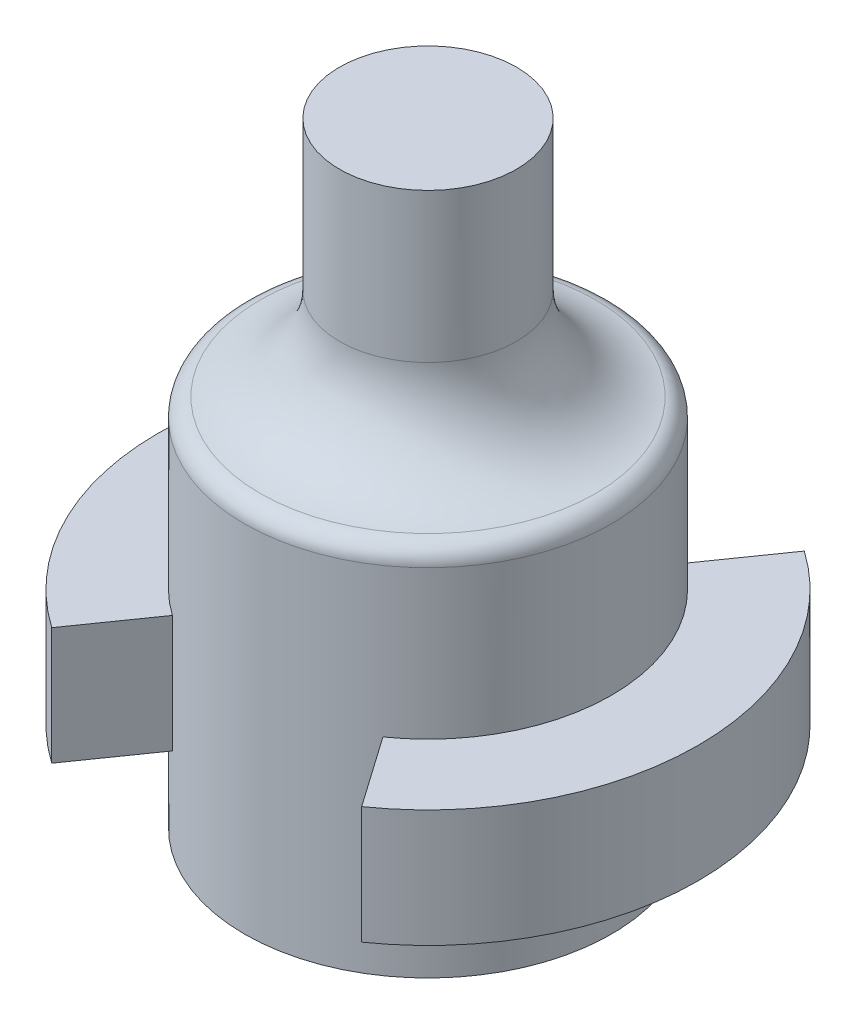
from build123d import *
from build123d.topology import SkipClean

# Parameters (mm, degrees)
SALIENTE_EXTRUIR1_START   = 0.4
SALIENTE_EXTRUIR1_DEPTH   = 3.15
SALIENTE_EXTRUIR1_2_DEPTH = 3.15
SALIENTE_EXTRUIR2_DEPTH   = 8
SALIENTE_EXTRUIR3_START   = -2
SALIENTE_EXTRUIR3_DEPTH   = 2
CROQUIS2_R                = 2.375
SALIENTE_EXTRUIR4_DEPTH   = 6.5
REDONDEO2_R               = 2.5
REDONDEO3_R               = 0.5


with BuildPart() as part:
    # Croquis1 → Saliente-Extruir1 (new body)
    with BuildSketch(Plane(origin=(0, 0, 0), x_dir=(1, 0, 0), z_dir=(0, 1, 0)).offset(SALIENTE_EXTRUIR1_START)):
        with BuildLine():
            Line((4.158429164, 5.938852321), (2.824863949, 4.034323818))
            ThreePointArc((2.824863949, 4.034323818), (4.925, 0), (2.824863949, -4.034323818))
            Line((2.824863949, -4.034323818), (4.158429164, -5.938852321))
            ThreePointArc((4.158429164, -5.938852321), (7.25, 0), (4.158429164, 5.938852321))
        make_face()
    extrude(amount=SALIENTE_EXTRUIR1_DEPTH)



with BuildPart() as body_2:
    # Croquis1 → Saliente-Extruir1 2 (new body)
    with BuildSketch(Plane(origin=(0, 0, 0), x_dir=(1, 0, 0), z_dir=(0, 1, 0)).offset(SALIENTE_EXTRUIR1_START)):
        with BuildLine():
            ThreePointArc((-2.824863949, -4.034323818), (-4.925, 0), (-2.824863949, 4.034323818))
            Line((-2.824863949, 4.034323818), (-4.158429164, 5.938852321))
            ThreePointArc((-4.158429164, 5.938852321), (-7.25, 0), (-4.158429164, -5.938852321))
            Line((-4.158429164, -5.938852321), (-2.824863949, -4.034323818))
        make_face()
    extrude(amount=SALIENTE_EXTRUIR1_2_DEPTH)


with BuildPart() as part_1:
    add(part.part)

    add(body_2.part)  # Saliente-Extruir2 merges body 2
    # Croquis1<3> → Saliente-Extruir2 (add)
    with BuildSketch(Plane(origin=(0, 0, 0), x_dir=(1, 0, 0), z_dir=(0, 1, 0))):
        with BuildLine():
            ThreePointArc((4.925, 0), (4.368528353, 2.27411192), (2.824863949, 4.034323818))
            ThreePointArc((2.824863949, 4.034323818), (0, 4.925), (-2.824863949, 4.034323818))
            ThreePointArc((-2.824863949, 4.034323818), (-4.925, 0), (-2.824863949, -4.034323818))
            ThreePointArc((-2.824863949, -4.034323818), (0, -4.925), (2.824863949, -4.034323818))
            ThreePointArc((2.824863949, -4.034323818), (4.368528353, -2.27411192), (4.925, 0))
        make_face()
    extrude(amount=SALIENTE_EXTRUIR2_DEPTH)

    # Croquis1<4> → Saliente-Extruir3 (add)
    with SkipClean():  # the faces are left unmerged after this step: merging them gives an invalid solid
        with BuildSketch(Plane(origin=(0, 0, 0), x_dir=(1, 0, 0), z_dir=(0, 1, 0)).offset(SALIENTE_EXTRUIR3_START)):
            with BuildLine():
                ThreePointArc((4.925, 0), (4.368528353, 2.27411192), (2.824863949, 4.034323818))
                ThreePointArc((2.824863949, 4.034323818), (0, 4.925), (-2.824863949, 4.034323818))
                ThreePointArc((-2.824863949, 4.034323818), (-4.925, 0), (-2.824863949, -4.034323818))
                ThreePointArc((-2.824863949, -4.034323818), (0, -4.925), (2.824863949, -4.034323818))
                ThreePointArc((2.824863949, -4.034323818), (4.368528353, -2.27411192), (4.925, 0))
            make_face()
        extrude(amount=SALIENTE_EXTRUIR3_DEPTH)

    # Croquis2 → Saliente-Extruir4 (add)
    with SkipClean():  # the faces are left unmerged after this step: merging them gives an invalid solid
        with BuildSketch(Plane(origin=(0, 8, 0), x_dir=(1, 0, 0), z_dir=(0, 1, 0))):
            Circle(CROQUIS2_R)
        extrude(amount=SALIENTE_EXTRUIR4_DEPTH)

    # Redondeo2
    redondeo2_edges = [part_1.edges().sort_by_distance(p)[0] for p in [
        (-2.375, 8, 0),
    ]]
    fillet(redondeo2_edges, radius=REDONDEO2_R)

    # Redondeo3
    redondeo3_edges = [part_1.edges().sort_by_distance(p)[0] for p in [
        (-2.824863949, 8, 4.034323818),
    ]]
    fillet(redondeo3_edges, radius=REDONDEO3_R)


solid = part_1.part
